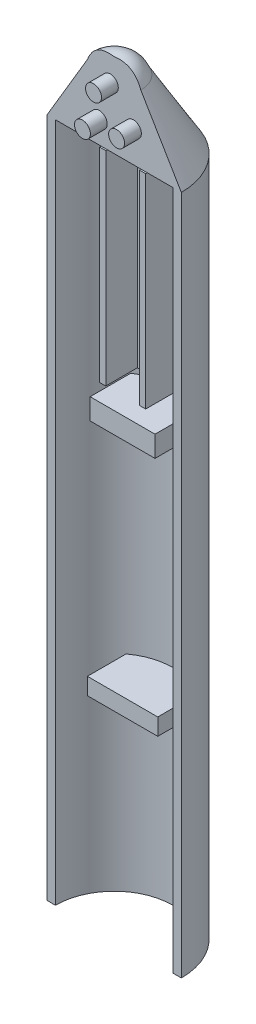
from build123d import *

# Parameters (mm, degrees)
SKETCH2_W           = 2
SKETCH2_H           = 162.039928857
SKETCH5_W           = 72.783621468
SKETCH5_H           = 192.84631039
CUT_EXTRUDE1_DEPTH  = 94.869329042
BOSS_EXTRUDE1_REACH = 97.869
BOSS_EXTRUDE1_START = -2
SKETCH4_W           = 15.457813272
SKETCH4_H           = 5
SKETCH4_W_2         = 16.763190872
SKETCH4_H_2         = 4
SKETCH4_W_3         = 1.5
SKETCH4_H_3         = 48.554461885
BOSS_EXTRUDE2_REACH = 105.369
BOSS_EXTRUDE2_START = -9.5
SKETCH4_4_W         = 8
SKETCH4_4_H         = 48.554461885
SKETCH6_R           = 1.9
BOSS_EXTRUDE3_DEPTH = 4


with BuildPart() as part:
    # Sketch1 → Revolve1 (revolve)
    with BuildSketch(Plane.XY):
        with BuildLine():
            Line((6.354000149, 87.279039692), (16, 71))
            Line((16, 71), (0, 71))
            Line((0, 71), (0, 91))
            add(Edge.make_bspline(
                [(0, 91), (4.668589185, 91.723642341), (6.354000149, 87.279039692)],
                knots=[0, 0, 0, 1, 1, 1], degree=2))
        make_face()
    revolve(axis=Axis((0, 91, 0), (0, -1, 0)))

    # Sketch2 → Revolve2 (revolve)
    with BuildSketch(Plane.XY):
        with Locations((15, -10.019964429)):
            Rectangle(SKETCH2_W, SKETCH2_H)
    revolve(axis=Axis((0, 91, 0), (0, -1, 0)))

    # Sketch5 → Cut-Extrude1 (cut, through all)
    with BuildSketch(Plane.XY):
        Rectangle(SKETCH5_W, SKETCH5_H)
    extrude(amount=CUT_EXTRUDE1_DEPTH, mode=Mode.SUBTRACT)

    # Sketch4 → Boss-Extrude1 (add, up to next)
    with BuildSketch(Plane.XY.offset(BOSS_EXTRUDE1_START), mode=Mode.PRIVATE) as boss_extrude1_sk1:
        with Locations((0, 13.5)):
            Rectangle(SKETCH4_W, SKETCH4_H)
    boss_extrude1_tool1 = extrude(boss_extrude1_sk1.sketch, amount=-BOSS_EXTRUDE1_REACH, mode=Mode.PRIVATE) - part.part
    # Sketch4 → Boss-Extrude1 (add, up to next)
    with BuildSketch(Plane.XY.offset(BOSS_EXTRUDE1_START), mode=Mode.PRIVATE) as boss_extrude1_sk2:
        with Locations((0, -44)):
            Rectangle(SKETCH4_W_2, SKETCH4_H_2)
    boss_extrude1_tool2 = extrude(boss_extrude1_sk2.sketch, amount=-BOSS_EXTRUDE1_REACH, mode=Mode.PRIVATE) - part.part
    # Sketch4 → Boss-Extrude1 (add, up to next)
    with BuildSketch(Plane.XY.offset(BOSS_EXTRUDE1_START), mode=Mode.PRIVATE) as boss_extrude1_sk3:
        with Locations((4.75, 44.344804049)):
            Rectangle(SKETCH4_W_3, SKETCH4_H_3)
    boss_extrude1_tool3 = extrude(boss_extrude1_sk3.sketch, amount=-BOSS_EXTRUDE1_REACH, mode=Mode.PRIVATE) - part.part
    # Sketch4 → Boss-Extrude1 (add, up to next)
    with BuildSketch(Plane.XY.offset(BOSS_EXTRUDE1_START), mode=Mode.PRIVATE) as boss_extrude1_sk4:
        with Locations((-4.75, 44.344804049)):
            Rectangle(SKETCH4_W_3, SKETCH4_H_3)
    boss_extrude1_tool4 = extrude(boss_extrude1_sk4.sketch, amount=-BOSS_EXTRUDE1_REACH, mode=Mode.PRIVATE) - part.part
    add(boss_extrude1_tool1.solids().sort_by_distance((0, 13.5, -2))[0])
    add(boss_extrude1_tool2.solids().sort_by_distance((0, -44, -2))[0])
    add(boss_extrude1_tool3.solids().sort_by_distance((4.75, 44.344804, -2))[0])
    add(boss_extrude1_tool4.solids().sort_by_distance((-4.75, 44.344804, -2))[0])

    # Sketch4<4> → Boss-Extrude2 (add, up to next)
    with BuildSketch(Plane.XY.offset(BOSS_EXTRUDE2_START), mode=Mode.PRIVATE) as boss_extrude2_sk1:
        with Locations((0, 44.344804049)):
            Rectangle(SKETCH4_4_W, SKETCH4_4_H)
    boss_extrude2_tool1 = extrude(boss_extrude2_sk1.sketch, amount=-BOSS_EXTRUDE2_REACH, mode=Mode.PRIVATE) - part.part
    add(boss_extrude2_tool1.solids().sort_by_distance((0, 44.344804, -9.5))[0])

    # Sketch6 → Boss-Extrude3 (add)
    with BuildSketch(Plane.XY):
        with Locations((4.579301858, 78.367512537)):
            Circle(SKETCH6_R)
        with Locations((-3.558513385, 76.255407818)):
            Circle(SKETCH6_R)
        with Locations((-0.919296183, 85.076551058)):
            Circle(SKETCH6_R)
    extrude(amount=BOSS_EXTRUDE3_DEPTH)


solid = part.part
